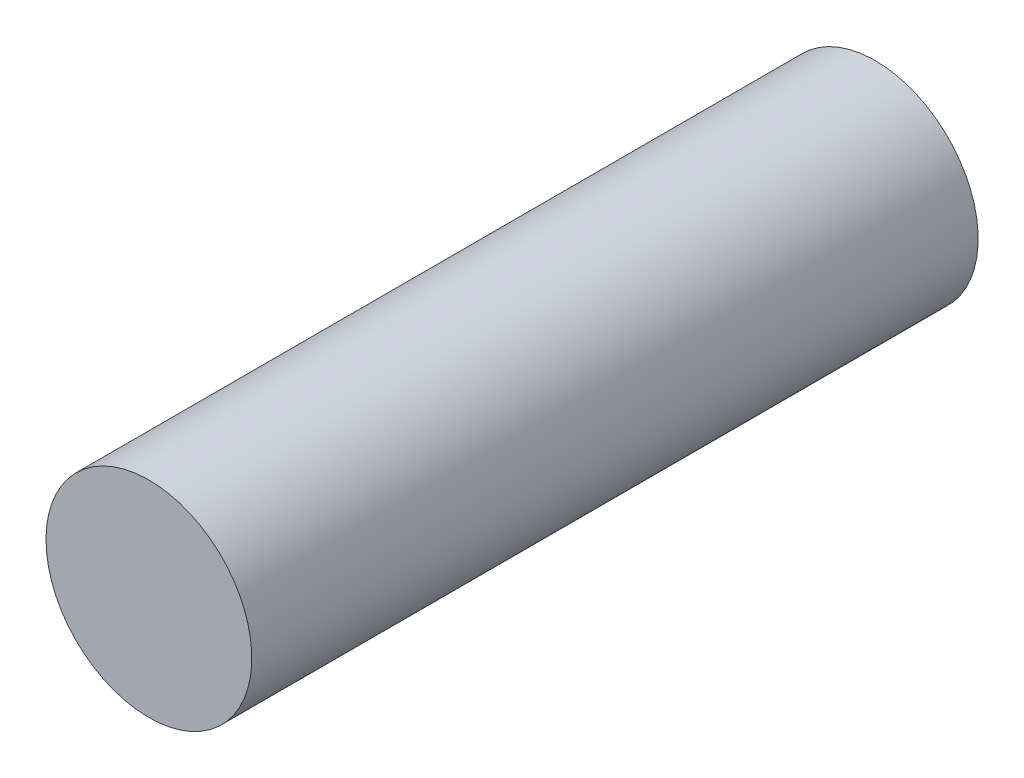
from build123d import *

# Parameters (mm, degrees)
SKETCH1_R      = 12.75
EXTRUDE1_DEPTH = 90


with BuildPart() as part:
    # Sketch1 → Extrude1 (new body)
    with BuildSketch(Plane.XY):
        with Locations(Location((0, 0, 0), (0, 0, 180))):
            Circle(SKETCH1_R)
    extrude(amount=EXTRUDE1_DEPTH)


solid = part.part
